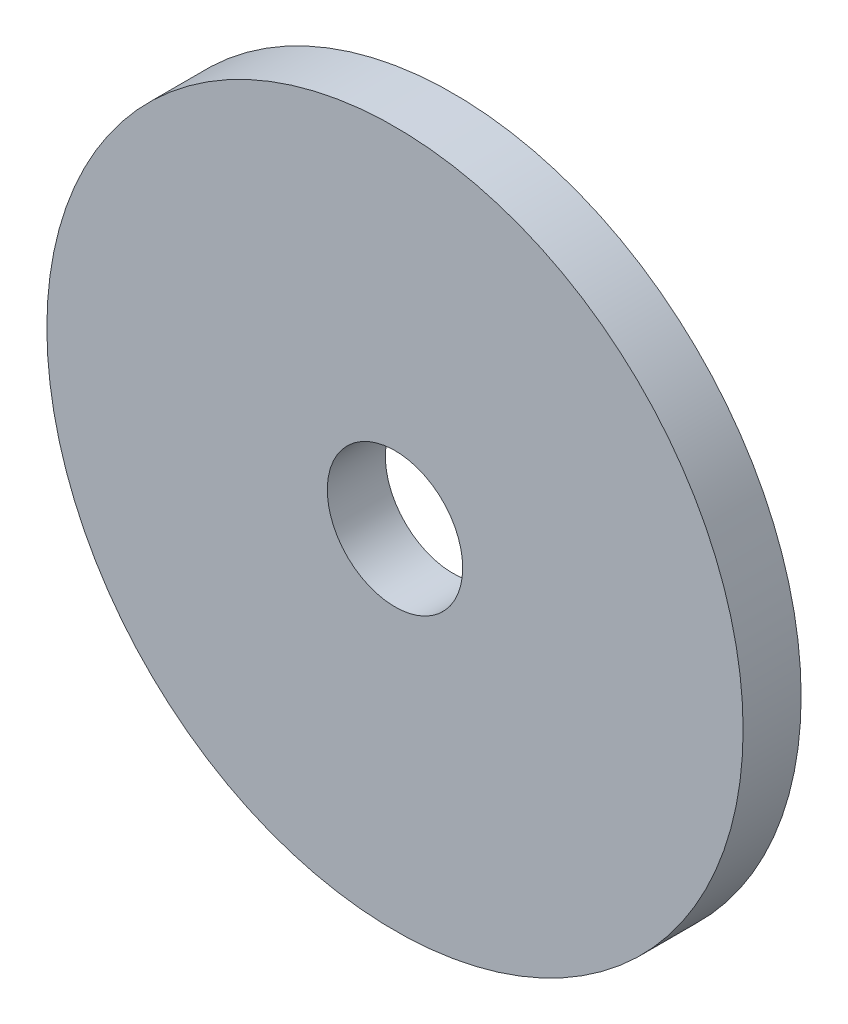
from build123d import *

# Parameters (mm, degrees)
SKETCH1_R           = 228.6
BOSS_EXTRUDE1_DEPTH = 38.1
SKETCH2_R           = 44.45
CUT_EXTRUDE1_DEPTH  = 38.1


with BuildPart() as part:
    # Sketch1 → Boss-Extrude1 (new body)
    with BuildSketch(Plane.XY):
        with Locations(Location((0, 0, 0), (0, 0, 180))):
            Circle(SKETCH1_R)
    extrude(amount=BOSS_EXTRUDE1_DEPTH)

    # Sketch2 → Cut-Extrude1 (cut)
    with BuildSketch(Plane.XY.offset(38.1)):
        Circle(SKETCH2_R)
    extrude(amount=-CUT_EXTRUDE1_DEPTH, mode=Mode.SUBTRACT)


solid = part.part
